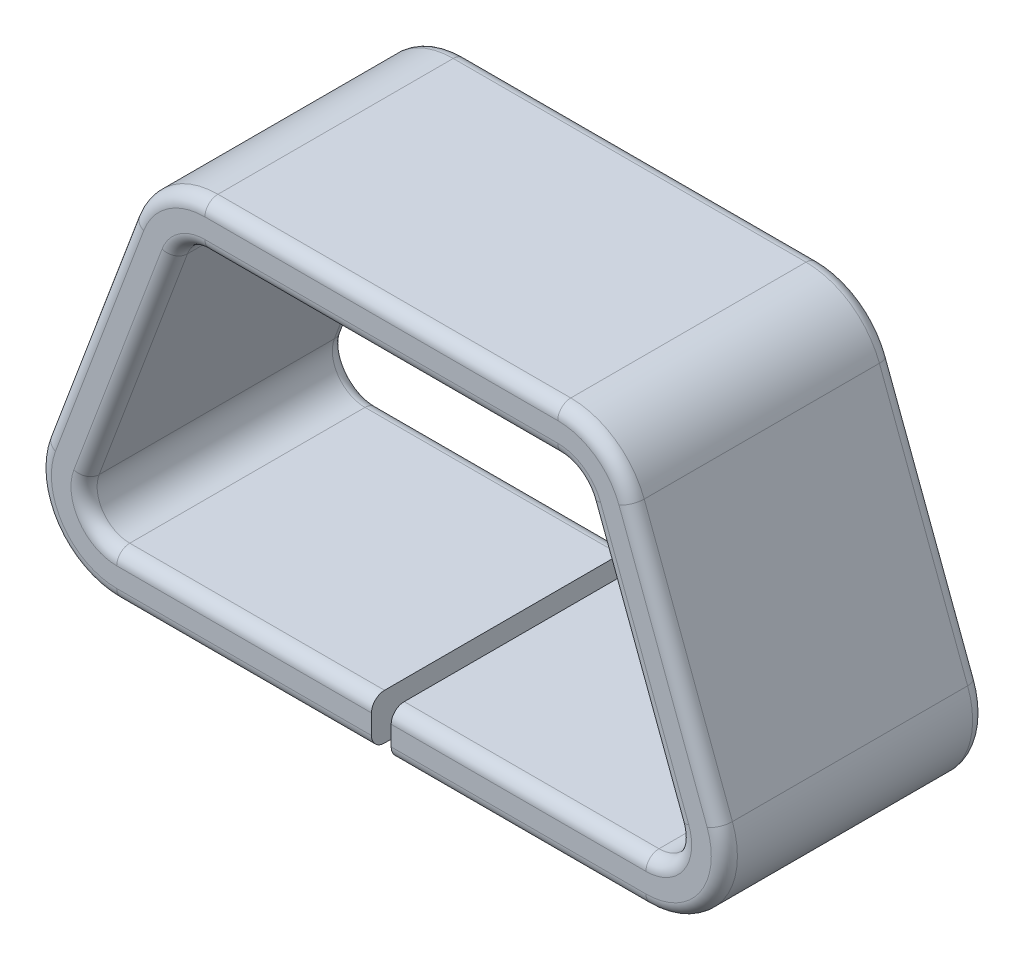
from build123d import *

# Parameters (mm, degrees)
BOSS_EXTRUDE1_DEPTH = 1.016
SHELL1_T            = -0.1778
SKETCH2_W           = 0.076603022
SKETCH2_H           = 1.147176972
CUT_EXTRUDE1_DEPTH  = 0.8128
FILLET7_R           = 0.0508


with BuildPart() as part:
    # Sketch1 → Boss-Extrude1 (new body)
    with BuildSketch(Plane.XY):
        with BuildLine():
            Line((-0.6858, 1.524), (0.6858, 1.524))
            ThreePointArc((0.6858, 1.524), (0.859412507, 1.469722928), (0.971193133, 1.326222425))
            Line((0.971193133, 1.326222425), (1.314093133, 0.411822425))
            ThreePointArc((1.314093133, 0.411822425), (1.279222928, 0.131187493), (1.0287, 0))
            Line((1.0287, 0), (-1.0287, 0))
            ThreePointArc((-1.0287, 0), (-1.279222928, 0.131187493), (-1.314093133, 0.411822425))
            Line((-1.314093133, 0.411822425), (-0.971193133, 1.326222425))
            ThreePointArc((-0.971193133, 1.326222425), (-0.859412507, 1.469722928), (-0.6858, 1.524))
        make_face()
    extrude(amount=BOSS_EXTRUDE1_DEPTH)

    # Shell1
    shell1_openings = [part.faces().sort_by_distance(p)[0] for p in [
        (0, 0.71233497, 1.016),
        (0, 0.71233497, 0),
    ]]
    offset(amount=SHELL1_T, openings=shell1_openings, kind=Kind.INTERSECTION)

    # Sketch2 → Cut-Extrude1 (cut)
    with BuildSketch(Plane.XZ):
        with Locations((0, 0.508)):
            Rectangle(SKETCH2_W, SKETCH2_H)
    extrude(amount=-CUT_EXTRUDE1_DEPTH, mode=Mode.SUBTRACT)

    # Fillet7
    fillet7_edges = [part.edges().sort_by_distance(p)[0] for p in [
        (-1.279222928, 0.131187493, 1.016),
        (-1.142643133, 0.869022425, 0),
        (-0.859412507, 1.469722928, 0),
        (-0.533500756, 0, 1.016),
        (1.279222928, 0.131187493, 1.016),
        (1.142643133, 0.869022425, 1.016),
        (0.859412507, 1.469722928, 1.016),
        (0, 1.524, 1.016),
        (-0.758138544, 1.323584553, 0),
        (-0.976163806, 0.806592677, 0),
        (-1.133084553, 0.232461456, 0),
        (-0.533500756, 0.1778, 0),
        (1.133084553, 0.232461456, 0),
        (0.976163806, 0.806592677, 0),
        (0.758138544, 1.323584553, 0),
        (0, 1.3462, 0),
        (-0.758138544, 1.323584553, 1.016),
        (-0.976163806, 0.806592677, 1.016),
        (-1.133084553, 0.232461456, 1.016),
        (-0.533500756, 0.1778, 1.016),
        (1.133084553, 0.232461456, 1.016),
        (0.976163806, 0.806592677, 1.016),
        (0.758138544, 1.323584553, 1.016),
        (0, 1.3462, 1.016),
        (-0.859412507, 1.469722928, 1.016),
        (0.533500756, 0.1778, 0),
        (0.533500756, 0.1778, 1.016),
        (0.533500756, 0, 0),
        (0.533500756, 0, 1.016),
        (-0.038301511, 0.0889, 0),
        (0.038301511, 0.0889, 0),
        (-1.142643133, 0.869022425, 1.016),
        (0, 1.524, 0),
        (0.859412507, 1.469722928, 0),
        (1.142643133, 0.869022425, 0),
        (1.279222928, 0.131187493, 0),
        (-0.533500756, 0, 0),
        (-1.279222928, 0.131187493, 0),
    ]]
    fillet(fillet7_edges, radius=FILLET7_R)


solid = part.part
